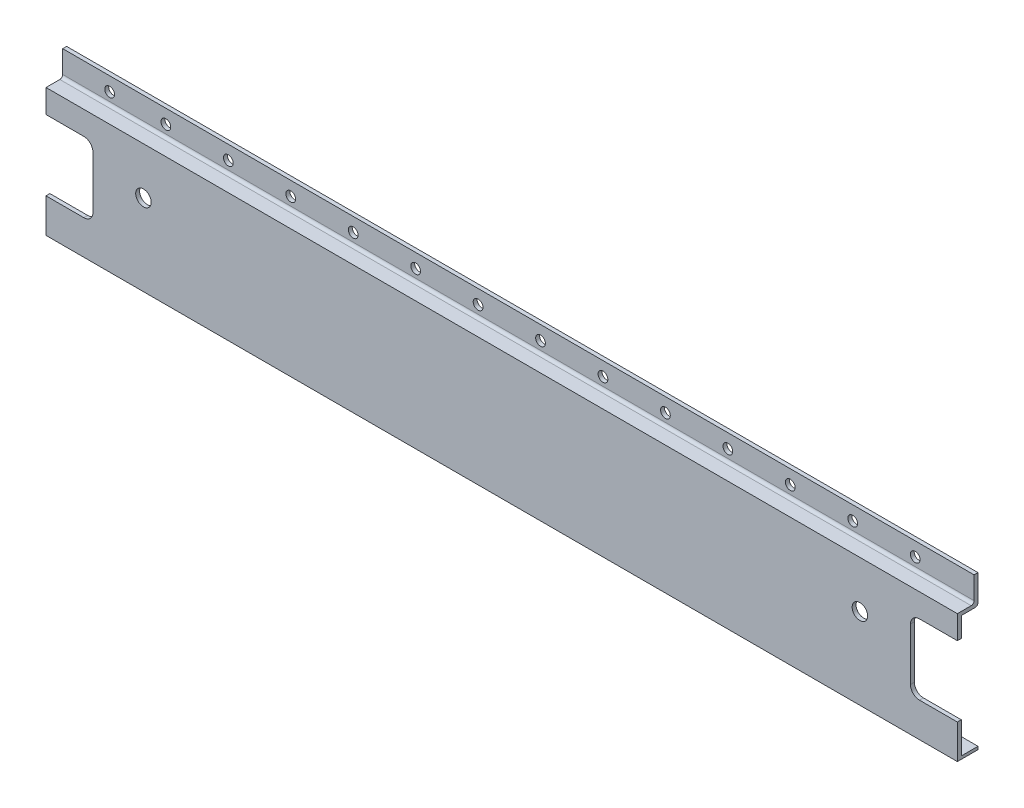
from build123d import *

# Parameters (mm, degrees)
SKETCH1_W           = 641.35
SKETCH1_H           = 107.95
BOSS_EXTRUDE1_DEPTH = 14.5161
SKETCH2_W           = 641.35
SKETCH2_H           = 17.78
CUT_EXTRUDE1_DEPTH  = 11.7602
SKETCH3_W           = 641.35
SKETCH3_H           = 85.5345
CUT_EXTRUDE3_DEPTH  = 11.7602
FILLET1_R           = 2.032
CUT_EXTRUDE4_DEPTH  = 326.398307546
SKETCH5_R           = 3.429
CUT_EXTRUDE5_DEPTH  = 11.7602
SKETCH6_R           = 5.461
CUT_EXTRUDE6_DEPTH  = 11.7602


with BuildPart() as part:
    # Sketch1 → Boss-Extrude1 (new body)
    with BuildSketch(Plane.XY):
        Rectangle(SKETCH1_W, SKETCH1_H)
    extrude(amount=BOSS_EXTRUDE1_DEPTH)

    # Sketch2 → Cut-Extrude1 (cut)
    with BuildSketch(Plane.XY.offset(14.5161)):
        with Locations((0, 45.085)):
            Rectangle(SKETCH2_W, SKETCH2_H)
    extrude(amount=-CUT_EXTRUDE1_DEPTH, mode=Mode.SUBTRACT)

    # Sketch3 → Cut-Extrude3 (cut)
    with BuildSketch(Plane(origin=(0, 0, 0), x_dir=(-1, 0, 0), z_dir=(0, 0, -1))):
        with Locations((0, -9.11225)):
            Rectangle(SKETCH3_W, SKETCH3_H)
    extrude(amount=-CUT_EXTRUDE3_DEPTH, mode=Mode.SUBTRACT)

    # Fillet1
    fillet1_edges = [part.edges().sort_by_distance(p)[0] for p in [
        (0, 36.195, 2.7559),
        (0, 33.655, 0),
    ]]
    fillet(fillet1_edges, radius=FILLET1_R)

    # Sketch4 → Cut-Extrude4 (cut, through all)
    with BuildSketch(Plane(origin=(0, 0, 11.7602), x_dir=(-1, 0, 0), z_dir=(0, 0, -1))):
        with BuildLine():
            Line((-294.005, 19.685), (-320.675, 19.685))
            Line((-320.675, 19.685), (-320.675, -29.845))
            Line((-320.675, -29.845), (-294.005, -29.845))
            ThreePointArc((-294.005, -29.845), (-289.514871939, -27.985128061), (-287.655, -23.495))
            Line((-287.655, -23.495), (-287.655, 13.335))
            ThreePointArc((-287.655, 13.335), (-289.514871939, 17.825128061), (-294.005, 19.685))
        make_face()
        with BuildLine():
            Line((294.005, -29.845), (320.675, -29.845))
            Line((320.675, -29.845), (320.675, 19.685))
            Line((320.675, 19.685), (294.005, 19.685))
            ThreePointArc((294.005, 19.685), (289.514871939, 17.825128061), (287.655, 13.335))
            Line((287.655, 13.335), (287.655, -23.495))
            ThreePointArc((287.655, -23.495), (289.514871939, -27.985128061), (294.005, -29.845))
        make_face()
    extrude(amount=-CUT_EXTRUDE4_DEPTH, mode=Mode.SUBTRACT)

    # Sketch5 → Cut-Extrude5 (cut)
    with BuildSketch(Plane(origin=(0, 0, 0), x_dir=(-1, 0, 0), z_dir=(0, 0, -1))):
        with Locations((-279.222061941, 44.148206771)):
            Circle(SKETCH5_R)
        with Locations((-235.280061941, 44.148206771)):
            Circle(SKETCH5_R)
        with Locations((-191.338061941, 44.148206771)):
            Circle(SKETCH5_R)
        with Locations((-147.396061941, 44.148206771)):
            Circle(SKETCH5_R)
        with Locations((-103.454061941, 44.148206771)):
            Circle(SKETCH5_R)
        with Locations((-59.512061941, 44.148206771)):
            Circle(SKETCH5_R)
        with Locations((-15.570061941, 44.148206771)):
            Circle(SKETCH5_R)
        with Locations((28.371938059, 44.148206771)):
            Circle(SKETCH5_R)
        with Locations((72.313938059, 44.148206771)):
            Circle(SKETCH5_R)
        with Locations((116.255938059, 44.148206771)):
            Circle(SKETCH5_R)
        with Locations((160.197938059, 44.148206771)):
            Circle(SKETCH5_R)
        with Locations((204.139938059, 44.148206771)):
            Circle(SKETCH5_R)
        with Locations((248.081938059, 44.148206771)):
            Circle(SKETCH5_R)
        with Locations((287.655, 44.148206771)):
            Circle(SKETCH5_R)
    extrude(amount=-CUT_EXTRUDE5_DEPTH, mode=Mode.SUBTRACT)

    # Sketch6 → Cut-Extrude6 (cut)
    with BuildSketch(Plane(origin=(0, 0, 11.7602), x_dir=(-1, 0, 0), z_dir=(0, 0, -1))):
        with Locations((-252.095, 3.175)):
            Circle(SKETCH6_R)
        with Locations((252.095, 3.175)):
            Circle(SKETCH6_R)
    extrude(amount=-CUT_EXTRUDE6_DEPTH, mode=Mode.SUBTRACT)


solid = part.part
